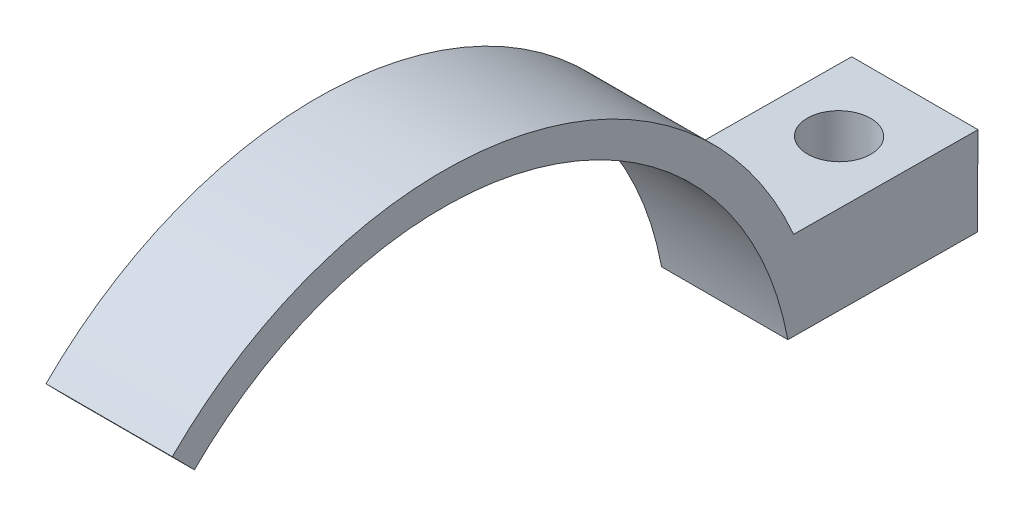
from build123d import *

# Parameters (mm, degrees)
BOSS_EXTRUDE1_DEPTH = 5
SKETCH6_W           = 10
SKETCH6_H           = 15
SKETCH6_R           = 2.5
BOSS_EXTRUDE2_DEPTH = 7


with BuildPart() as part:
    # Sketch5 → Boss-Extrude1 (new, symmetric)
    with BuildSketch(Plane(origin=(0, 0, 0), x_dir=(0, 0, -1), z_dir=(1, 0, 0))):
        with BuildLine():
            Line((-19.663469321, 19.634120506), (-21.416496635, 21.416496635))
            ThreePointArc((-21.416496635, 21.416496635), (9.210493666, 28.853066781), (29.864087216, 5.046677222))
            Line((29.864087216, 5.046677222), (27.321571741, 5.067783672))
            ThreePointArc((27.321571741, 5.067783672), (8.228376229, 26.541374087), (-19.663469321, 19.634120506))
        make_face()
    extrude(amount=BOSS_EXTRUDE1_DEPTH, both=True)

    # Sketch6 → Boss-Extrude2 (add)
    with BuildSketch(Plane(origin=(0, 5.294226257, -0.043949516), x_dir=(1, 0, 0), z_dir=(0, -0.9999655451195217, 0.008301118829285392))):
        with Locations((0, -34.778562105)):
            Rectangle(SKETCH6_W, SKETCH6_H)
        with Locations(Location((0, -36.278562105, 0), (0, 0, 270))):
            Circle(SKETCH6_R, mode=Mode.SUBTRACT)
    extrude(amount=-BOSS_EXTRUDE2_DEPTH)


solid = part.part
